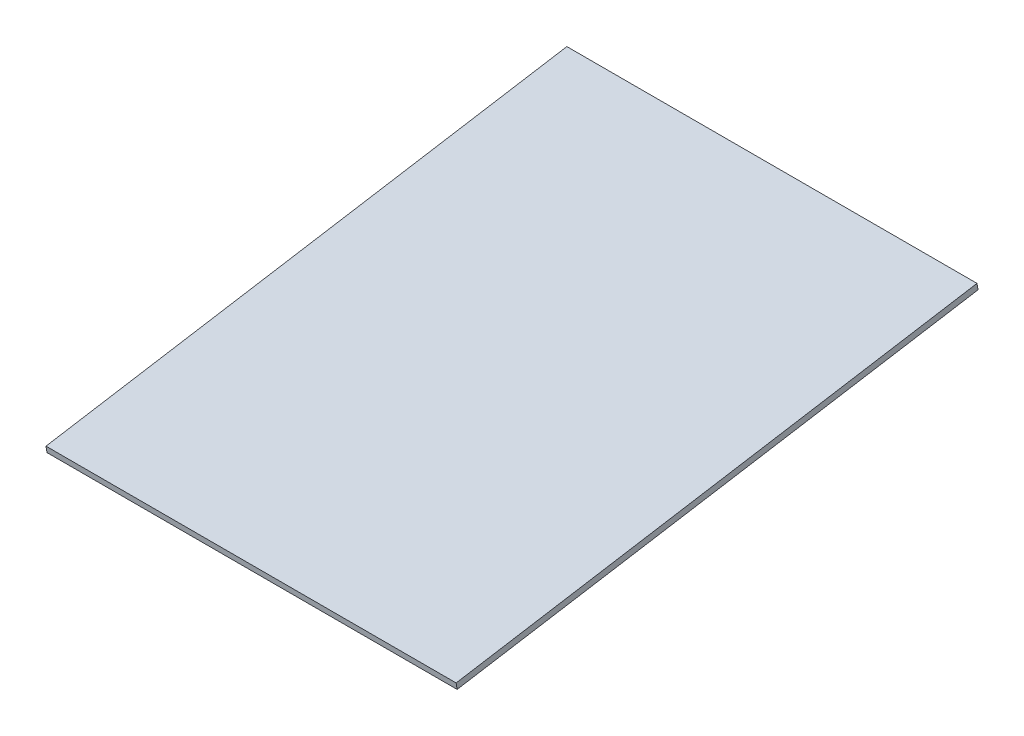
from build123d import *

# Parameters (mm, degrees)
BOSS_EXTRUDE1_DEPTH = 3.175


with BuildPart() as part:
    # Sketch1 → Boss-Extrude1 (new body)
    with BuildSketch(Plane(origin=(0, 543.876210596, 89.384698965), x_dir=(1, 0, 0), z_dir=(0, 0.9867625124381899, 0.16217195826242994))):
        Polygon((100, -954.242157057), (-100, -954.242157057), (-109.652, -954.242157057), (-109.652, -1224.067157157), (-100, -1224.067157157), (100, -1224.067157157), align=None)
    extrude(amount=-BOSS_EXTRUDE1_DEPTH)


solid = part.part
